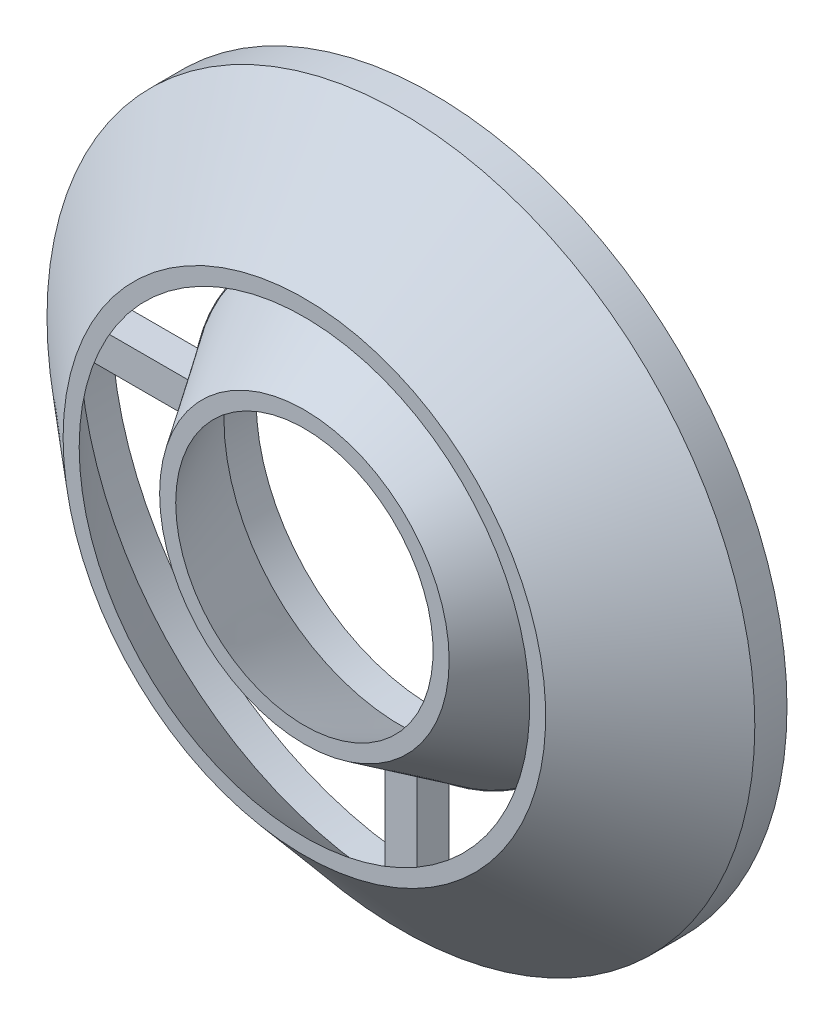
from build123d import *

# Parameters (mm, degrees)
SKETCH_2_R      = 22
SKETCH_2_R_2    = 11
EXTRUDE_1_DEPTH = 2


with BuildPart() as part:
    # Эскиз2 → Бобышка-Вытянуть1 (new body)
    with BuildSketch(Plane.XY):
        Circle(SKETCH_2_R)
        with BuildLine():
            Line((12.961481397, -1), (19.974984355, -1))
            ThreePointArc((19.974984355, -1), (14.142135624, -14.142135624), (1, -19.974984355))
            Line((1, -19.974984355), (1, -12.961481397))
            ThreePointArc((1, -12.961481397), (9.192388155, -9.192388155), (12.961481397, -1))
        make_face(mode=Mode.SUBTRACT)
        with BuildLine():
            Line((19.974984355, 1), (12.961481397, 1))
            ThreePointArc((12.961481397, 1), (9.192388155, 9.192388155), (1, 12.961481397))
            Line((1, 12.961481397), (1, 19.974984355))
            ThreePointArc((1, 19.974984355), (14.142135624, 14.142135624), (19.974984355, 1))
        make_face(mode=Mode.SUBTRACT)
        with BuildLine():
            Line((-1, 19.974984355), (-1, 12.961481397))
            ThreePointArc((-1, 12.961481397), (-9.192388155, 9.192388155), (-12.961481397, 1))
            Line((-12.961481397, 1), (-19.974984355, 1))
            ThreePointArc((-19.974984355, 1), (-14.142135624, 14.142135624), (-1, 19.974984355))
        make_face(mode=Mode.SUBTRACT)
        with BuildLine():
            Line((-19.974984355, -1), (-12.961481397, -1))
            ThreePointArc((-12.961481397, -1), (-9.192388155, -9.192388155), (-1, -12.961481397))
            Line((-1, -12.961481397), (-1, -19.974984355))
            ThreePointArc((-1, -19.974984355), (-14.142135624, -14.142135624), (-19.974984355, -1))
        make_face(mode=Mode.SUBTRACT)
        Circle(SKETCH_2_R_2, mode=Mode.SUBTRACT)
    extrude(amount=EXTRUDE_1_DEPTH)

    # Эскиз4 → Повернуть1 (revolve)
    with BuildSketch(Plane(origin=(0, 0, 0), x_dir=(1, 0, 0), z_dir=(0, 1, 0)), mode=Mode.PRIVATE) as revolve_1_sk:
        Polygon((11, -2), (8, -8), (9, -8), (12.961481397, -2), align=None)
        Polygon((14, -8), (19.974984355, -2), (22, -2), (15, -8), align=None)
    revolve(revolve_1_sk.sketch.rotate(Axis((0, 0, -0.4), (0, 0, 1)), 180), axis=Axis((0, 0, -0.4), (0, 0, 1)))


solid = part.part
